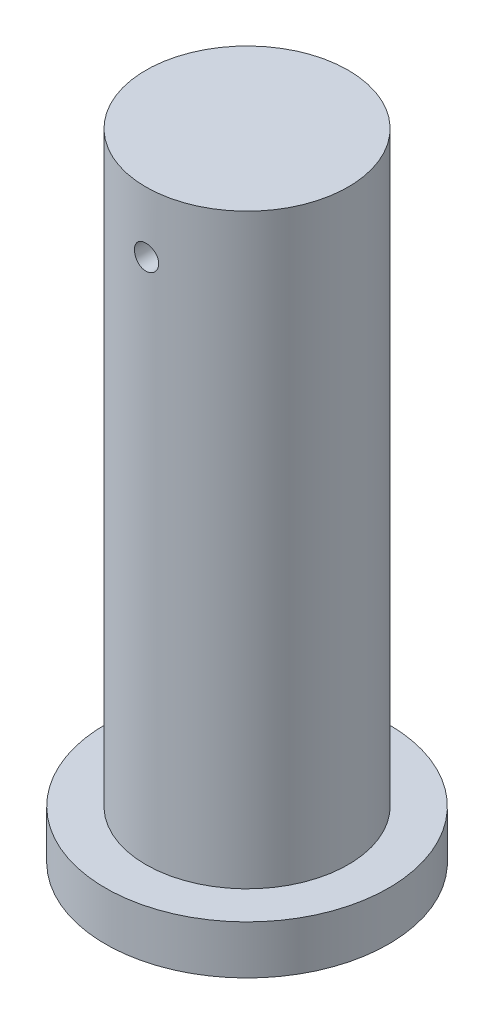
from build123d import *

# Parameters (mm, degrees)
CUT_EXTRUDE1_DEPTH      = 165.61773902
CUT_EXTRUDE1_DEPTH_BACK = 165.61773902
SKETCH2_R               = 3


with BuildPart() as part:
    # Sketch1 → Revolve1 (revolve)
    with BuildSketch(Plane.YZ, mode=Mode.PRIVATE) as revolve1_sk:
        Polygon((0, 0), (0, 25), (-145, 25), (-145, 35), (-157, 35), (-157, 0), align=None)
    revolve(revolve1_sk.sketch.rotate(Axis((0, -157, 0), (0, 1, 0)), 180), axis=Axis((0, -157, 0), (0, 1, 0)))

    # Sketch2 → Cut-Extrude1 (cut, two sides: drawn at the far end of the back side and taken through both)
    with BuildSketch(Plane(origin=(0, 0, 0), x_dir=(0, 1, 0), z_dir=(0, 0, 1)).offset(-CUT_EXTRUDE1_DEPTH_BACK)):
        with Locations(Location((-15, 0, 0), (0, 0, 270))):
            Circle(SKETCH2_R)
    extrude(amount=CUT_EXTRUDE1_DEPTH + CUT_EXTRUDE1_DEPTH_BACK, mode=Mode.SUBTRACT)


solid = part.part
